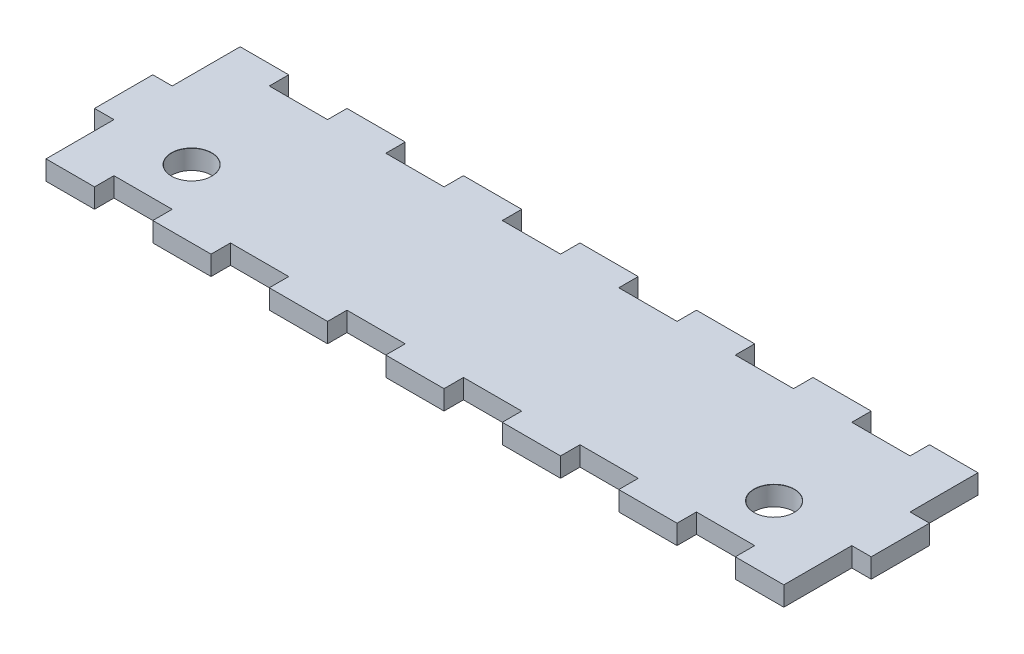
from build123d import *

# Parameters (mm, degrees)
BOSS_EXTRUDE1_DEPTH                 = 1.5
F_6_2_6_2_DIAMETER_HOLE1_AT_2_COUNT = 2
F_6_2_6_2_DIAMETER_HOLE1_AT_2_PITCH = 90


with BuildPart() as part:
    # Sketch1 → Boss-Extrude1 (new, symmetric)
    with BuildSketch(Plane(origin=(0, 0, 0), x_dir=(1, 0, 0), z_dir=(0, 1, 0))):
        Polygon((57, 15), (49.5, 15), (49.5, 12), (40.5, 12), (40.5, 15), (31.5, 15), (31.5, 12), (22.5, 12), (22.5, 15), (13.5, 15), (13.5, 12), (4.5, 12), (4.5, 15), (-4.5, 15), (-4.5, 12), (-13.5, 12), (-13.5, 15), (-22.5, 15), (-22.5, 12), (-31.5, 12), (-31.5, 15), (-40.5, 15), (-40.5, 12), (-49.5, 12), (-49.5, 15), (-57, 15), (-57, 12), (-57, 4.5), (-60, 4.5), (-60, -4.5), (-57, -4.5), (-57, -12), (-57, -15), (-49.5, -15), (-49.5, -12), (-40.5, -12), (-40.5, -15), (-31.5, -15), (-31.5, -12), (-22.5, -12), (-22.5, -15), (-13.5, -15), (-13.5, -12), (-4.5, -12), (-4.5, -15), (4.5, -15), (4.5, -12), (13.5, -12), (13.5, -15), (22.5, -15), (22.5, -12), (31.5, -12), (31.5, -15), (40.5, -15), (40.5, -12), (49.5, -12), (49.5, -15), (57, -15), (57, -12), (57, -4.5), (60, -4.5), (60, 4.5), (57, 4.5), (57, 12), align=None)
    extrude(amount=BOSS_EXTRUDE1_DEPTH, both=True)

    # Sketch4 → Ø6.2 (6.2) Diameter Hole1 (revolve, cut)
    with BuildSketch(Plane(origin=(-45, 1.5, 4.5), x_dir=(0, 0, 1), z_dir=(1, 0, 0))):
        Polygon((0, 0), (0, 3), (3.1, 3), (3.1, 0.025), (3.125, 0), align=None)
    f_6_2_6_2_diameter_hole1 = revolve(axis=Axis((-45, 7.85, 4.5), (0, -1, 0)), mode=Mode.SUBTRACT)

    # Ø6.2 (6.2) Diameter Hole1 at 2: Ø6.2 (6.2) Diameter Hole1 ×2
    with Locations(*[(i * F_6_2_6_2_DIAMETER_HOLE1_AT_2_PITCH, 0, 0) for i in range(1, F_6_2_6_2_DIAMETER_HOLE1_AT_2_COUNT)]):
        add(f_6_2_6_2_diameter_hole1, mode=Mode.SUBTRACT)


solid = part.part
